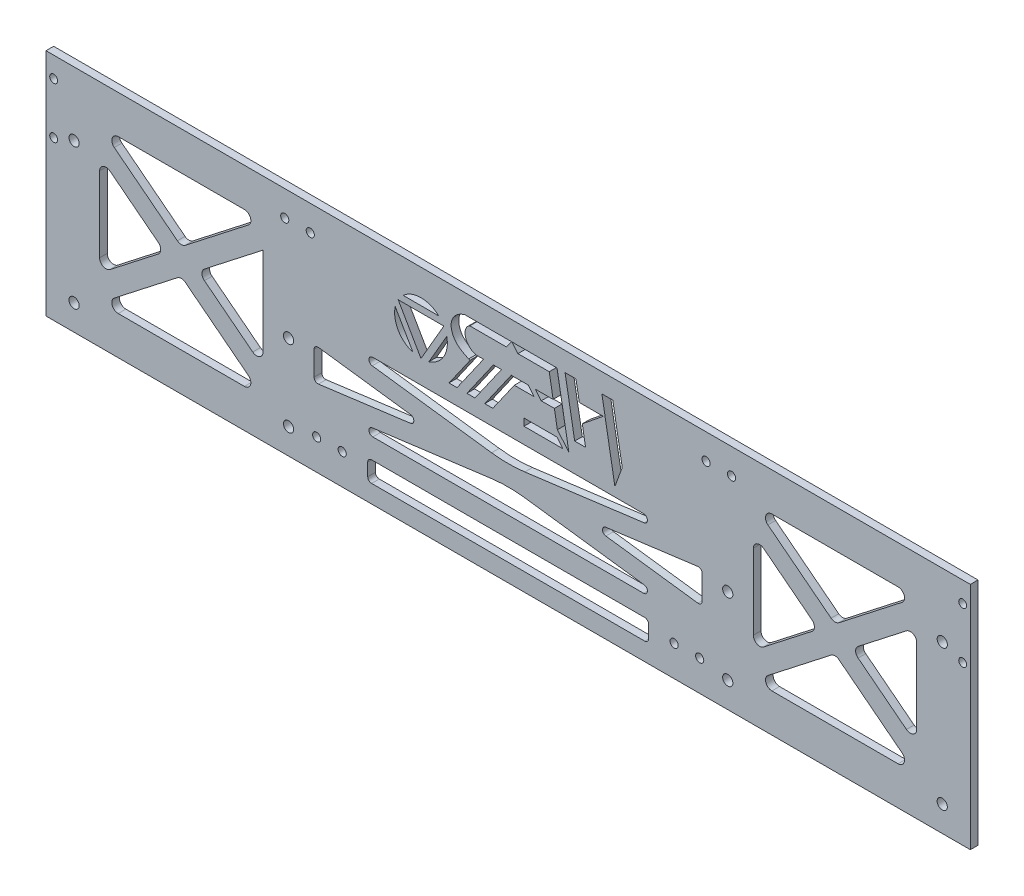
from build123d import *

# Parameters (mm, degrees)
SKETCH_1_W          = 362
SKETCH_1_H          = 90
SKETCH_1_R          = 2
EXTRUDE_1_DEPTH     = 3
SKETCH_2_R          = 1.6
CUT_EXTRUDE_1_DEPTH = 187.534179174
SKETCH_4_W          = 110
SKETCH_4_H          = 8
SKETCH_4_W_2        = 152
SKETCH_4_H_2        = 27
SKETCH_4_W_3        = 64
SKETCH_4_H_3        = 60
CUT_EXTRUDE_2_DEPTH = 187.534179174
EXTRUDE_2_DEPTH     = 3
FILLET_2_R          = 2.5
FILLET_3_R          = 1.5
FILLET_4_R          = 50
SKETCH_6_R          = 1.55
CUT_EXTRUDE_3_DEPTH = 187.534179296


with BuildPart() as part:
    # 草图1 → 凸台-拉伸1 (new body)
    with BuildSketch(Plane.XY):
        Rectangle(SKETCH_1_W, SKETCH_1_H)
        with Locations((-170, 20)):
            Circle(SKETCH_1_R, mode=Mode.SUBTRACT)
        with Locations((-170, -35)):
            Circle(SKETCH_1_R, mode=Mode.SUBTRACT)
        with Locations((170, 20)):
            Circle(SKETCH_1_R, mode=Mode.SUBTRACT)
        with Locations((170, -35)):
            Circle(SKETCH_1_R, mode=Mode.SUBTRACT)
        with Locations((-86, -5)):
            Circle(SKETCH_1_R, mode=Mode.SUBTRACT)
        with Locations((-86, -35)):
            Circle(SKETCH_1_R, mode=Mode.SUBTRACT)
        with Locations((86, -5)):
            Circle(SKETCH_1_R, mode=Mode.SUBTRACT)
        with Locations((86, -35)):
            Circle(SKETCH_1_R, mode=Mode.SUBTRACT)
    extrude(amount=EXTRUDE_1_DEPTH)

    # 草图2 → 切除-拉伸1 (cut, through all)
    with BuildSketch(Plane.XY.offset(3)):
        with Locations((-75, -33)):
            Circle(SKETCH_2_R)
        with Locations((-65, -33)):
            Circle(SKETCH_2_R)
        with Locations((65, -33)):
            Circle(SKETCH_2_R)
        with Locations((75, -33)):
            Circle(SKETCH_2_R)
        with Locations((-87.5, 35)):
            Circle(SKETCH_2_R)
        with Locations((-77.5, 35)):
            Circle(SKETCH_2_R)
        with Locations((77.5, 35)):
            Circle(SKETCH_2_R)
        with Locations((87.5, 35)):
            Circle(SKETCH_2_R)
    extrude(amount=-CUT_EXTRUDE_1_DEPTH, mode=Mode.SUBTRACT)

    # 草图4 → 切除-拉伸2 (cut, through all)
    with BuildSketch(Plane.XY.offset(3)):
        with Locations((0, -34)):
            Rectangle(SKETCH_4_W, SKETCH_4_H)
        with BuildLine():
            Line((-31.038208398, 14.498113376), (-24.062861185, 26.57976915))
            ThreePointArc((-24.062861185, 26.57976915), (-25.201440884, 19.182691263), (-31.038208398, 14.498113376))
        make_face()
        Polygon((-25.201440884, 29.507691263), (-34.143153178, 14.020191263), (-43.084865472, 29.507691263), align=None)
        Polygon((-16.169405115, 11.220191263), (-5.797713223, 26.032502365), (-2.635907039, 26.032502365), (-13.00759893, 11.220191263), align=None)
        with BuildLine():
            Line((-14.76554047, 23.232502365), (-15.46554047, 23.232502365))
            add(Edge.make_bspline(
                [(-15.46554047, 23.232502365), (-15.541272441, 23.269603775), (-21.049660421, 25.386942131), (-22.769472164, 30.958354113), (-21.899024747, 33.697990435), (-20.130670732, 36.231981168), (-18.274714464, 37.094485075), (-16.931648347, 37.470191263)],
                knots=[0, 0, 0, 0, 0.322816734, 0.607041141, 0.715414806, 0.78027055, 1, 1, 1, 1], degree=3))
            Line((-16.931648347, 37.470191263), (1.268351653, 37.470191263))
            Line((1.268351653, 37.470191263), (-0.692229454, 34.670191263))
            Line((-0.692229454, 34.670191263), (-15.037740408, 34.670191263))
            add(Edge.make_bspline(
                [(-15.037740408, 34.670191263), (-16.493262418, 33.895919662), (-17.891204545, 29.745150127), (-14.537960268, 26.306413228), (-12.272671839, 26.032502365)],
                knots=[0, 0, 0, 0, 0.403413584, 1, 1, 1, 1], degree=3))
            Line((-12.272671839, 26.032502365), (-9.643153178, 26.032502365))
            Line((-9.643153178, 26.032502365), (-20.01484507, 11.220191263))
            Line((-20.01484507, 11.220191263), (-23.176651255, 11.220191263))
            Line((-23.176651255, 11.220191263), (-14.76554047, 23.232502365))
        make_face()
        Polygon((3.82783062, 34.670191263), (1.478351653, 37.470191263), (19.138108216, 37.470191263), (23.766691459, 11.220191263), (19.267178191, 16.582502365), (18.09460377, 23.232502365), (12.950367191, 23.232502365), (10.600888224, 26.032502365), (17.600888224, 26.032502365), (16.07783062, 34.670191263), align=None)
        Polygon((10.209011883, 23.232502365), (2.410757994, 23.232502365), (-6.000352791, 11.220191263), (-9.162158976, 11.220191263), (1.209532916, 26.032502365), (7.859532916, 26.032502365), align=None)
        with BuildLine():
            Line((-44.223445171, 26.57976915), (-37.248097958, 14.498113376))
            ThreePointArc((-37.248097958, 14.498113376), (-43.084865472, 19.182691263), (-44.223445171, 26.57976915))
        make_face()
        Polygon((41.797589146, 8.576773249), (36.702899986, 37.470191263), (40.967691755, 37.470191263), (44.67055835, 16.470191263), align=None)
        with BuildLine():
            Line((-27.167805964, 31.957691263), (-41.118500392, 31.957691263))
            ThreePointArc((-41.118500392, 31.957691263), (-34.143153178, 34.670191263), (-27.167805964, 31.957691263))
        make_face()
        Polygon((21.482228703, 11.220191263), (6.182749736, 11.220191263), (6.182749736, 14.020191263), (19.132749736, 14.020191263), align=None)
        Polygon((29.021477715, 23.470191263), (30.317481024, 16.120191263), (26.052689254, 16.120191263), (22.288108216, 37.470191263), (26.552899986, 37.470191263), (27.848903294, 30.120191263), (37.233543806, 30.120191263), align=None)
        with Locations((0, -8.5)):
            Rectangle(SKETCH_4_W_2, SKETCH_4_H_2)
        with Locations((128, 0)):
            Rectangle(SKETCH_4_W_3, SKETCH_4_H_3)
        with Locations((-128, 0)):
            Rectangle(SKETCH_4_W_3, SKETCH_4_H_3)
    extrude(amount=-CUT_EXTRUDE_2_DEPTH, mode=Mode.SUBTRACT)

    # 草图5 → 凸台-拉伸2 (add)
    with BuildSketch(Plane(origin=(0, 0, 0), x_dir=(-1, 0, 0), z_dir=(0, 0, -1))):
        Polygon((-160, 30), (-128, 5.070559916), (-96, 30), (-96, 19.858880169), (-121.491313212, 0), (-96, -19.858880169), (-96, -30), (-128, -5.070559916), (-160, -30), (-160, -19.858880169), (-134.508686788, 0), (-160, 19.858880169), align=None)
        Polygon((96, 30), (128, 5.070559916), (160, 30), (160, 19.858880169), (134.508686788, 0), (160, -19.858880169), (160, -30), (128, -5.070559916), (96, -30), (96, -19.858880169), (121.491313212, 0), (96, 19.858880169), align=None)
        Polygon((76, 5), (0, -4.970012124), (-76, 5), (-76, -2.059975751), (-26.908601033, -8.5), (-76, -14.940024249), (-76, -22), (0, -12.029987876), (76, -22), (76, -14.940024249), (26.908601033, -8.5), (76, -2.059975751), align=None)
    extrude(amount=-EXTRUDE_2_DEPTH)

    # 圆角2
    fillet_2_edges = [part.edges().sort_by_distance(p)[0] for p in [
        (-160, -30, 1.5),
        (-160, 30, 1.5),
        (-96, 30, 1.5),
        (-96, -30, 1.5),
        (96, -30, 1.5),
        (96, 30, 1.5),
        (160, 30, 1.5),
        (160, -30, 1.5),
        (134.508686788, 0, 1.5),
        (160, -19.858880169, 1.5),
        (128, -5.070559916, 1.5),
        (96, -19.858880169, 1.5),
        (121.491313212, 0, 1.5),
        (96, 19.858880169, 1.5),
        (128, 5.070559916, 1.5),
        (160, 19.858880169, 1.5),
        (-121.491313212, 0, 1.5),
        (-96, -19.858880169, 1.5),
        (-128, -5.070559916, 1.5),
        (-160, -19.858880169, 1.5),
        (-134.508686788, 0, 1.5),
        (-160, 19.858880169, 1.5),
        (-128, 5.070559916, 1.5),
    ]]
    fillet(fillet_2_edges, radius=FILLET_2_R)

    # 圆角3
    fillet_3_edges = [part.edges().sort_by_distance(p)[0] for p in [
        (55, -30, 1.5),
        (55, -38, 1.5),
        (-55, -38, 1.5),
        (-55, -30, 1.5),
        (-76, -22, 1.5),
        (-76, 5, 1.5),
        (76, 5, 1.5),
        (76, -22, 1.5),
        (26.908601033, -8.5, 1.5),
        (76, -14.940024249, 1.5),
        (-76, -14.940024249, 1.5),
        (-26.908601033, -8.5, 1.5),
        (-76, -2.059975751, 1.5),
        (76, -2.059975751, 1.5),
    ]]
    fillet(fillet_3_edges, radius=FILLET_3_R)

    # 圆角4
    fillet_4_edges = [part.edges().sort_by_distance(p)[0] for p in [
        (0, -12.029987876, 1.5),
        (0, -4.970012124, 1.5),
    ]]
    fillet(fillet_4_edges, radius=FILLET_4_R)

    # 草图6 → 切除-拉伸3 (cut, through all)
    with BuildSketch(Plane.XY.offset(3)):
        with Locations((-178, 37)):
            Circle(SKETCH_6_R)
        with Locations((-178, 17)):
            Circle(SKETCH_6_R)
        with Locations((178, 37)):
            Circle(SKETCH_6_R)
        with Locations((178, 17)):
            Circle(SKETCH_6_R)
    extrude(amount=-CUT_EXTRUDE_3_DEPTH, mode=Mode.SUBTRACT)


solid = part.part
